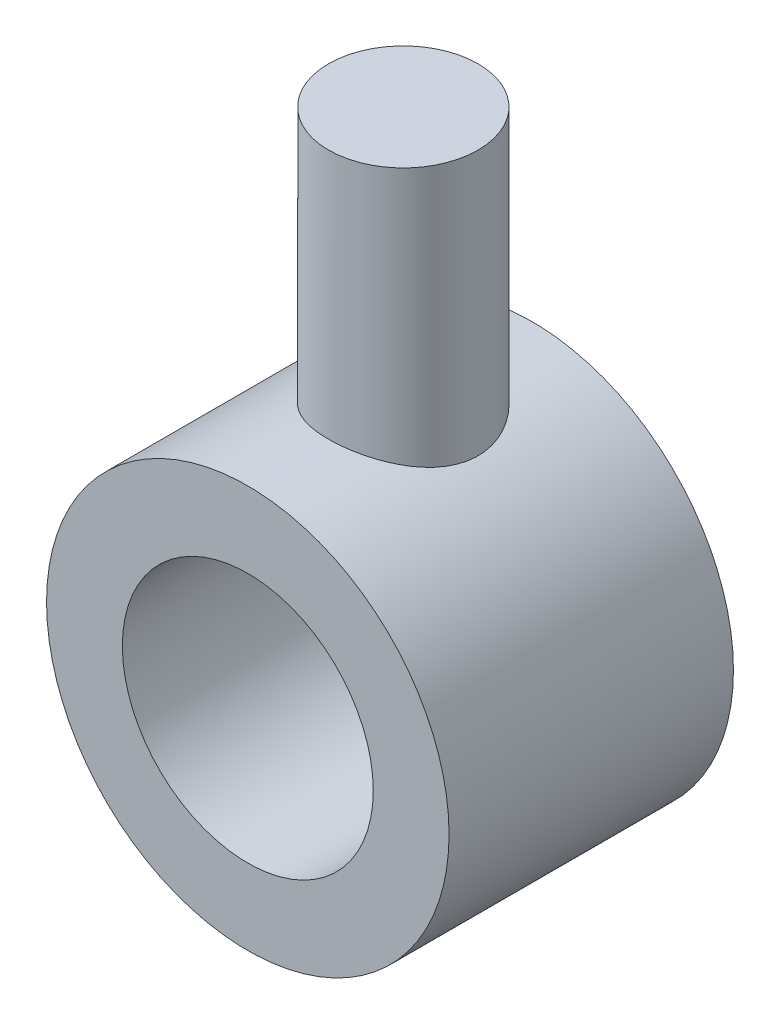
from build123d import *

# Parameters (mm, degrees)
SKETCH1_R           = 12.03113177
SKETCH1_R_2         = 7.5
BOSS_EXTRUDE1_DEPTH = 17
SKETCH2_R           = 4.468928123
BOSS_EXTRUDE2_DEPTH = 17


with BuildPart() as part:
    # Sketch1 → Boss-Extrude1 (new body)
    with BuildSketch(Plane.XY):
        Circle(SKETCH1_R)
        Circle(SKETCH1_R_2, mode=Mode.SUBTRACT)
    extrude(amount=BOSS_EXTRUDE1_DEPTH)

    # Sketch2 → Boss-Extrude2 (add)
    with BuildSketch(Plane(origin=(0, 10, 0), x_dir=(1, 0, 0), z_dir=(0, 1, 0))):
        with Locations(Location((0, -7.704324195, 0), (0, 0, 90))):
            Circle(SKETCH2_R)
    extrude(amount=BOSS_EXTRUDE2_DEPTH)


solid = part.part
